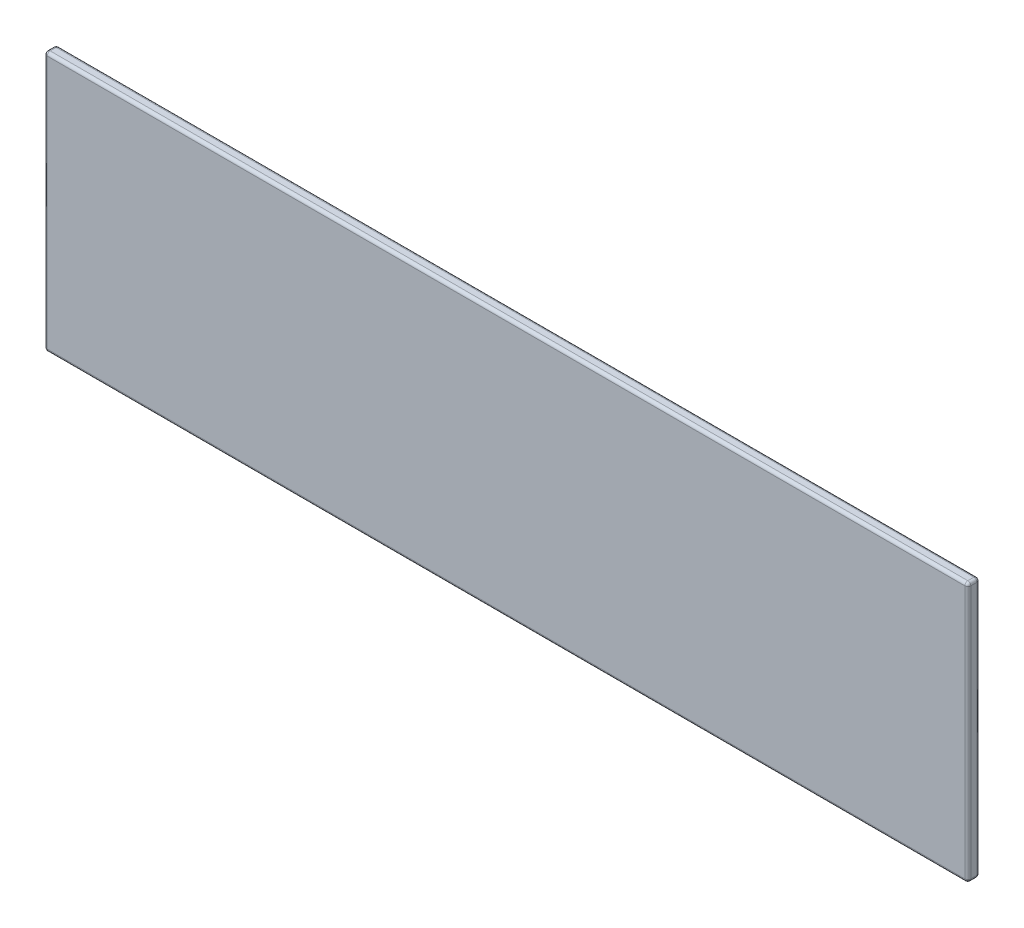
from build123d import *

# Parameters (mm, degrees)
SKETCH1_W           = 154.7
SKETCH1_H           = 43.5
BOSS_EXTRUDE1_DEPTH = 2
FILLET1_R           = 0.5


with BuildPart() as part:
    # Sketch1 → Boss-Extrude1 (new body)
    with BuildSketch(Plane.XY):
        Rectangle(SKETCH1_W, SKETCH1_H)
    extrude(amount=BOSS_EXTRUDE1_DEPTH)

    # Fillet1
    fillet1_edges = [part.edges().sort_by_distance(p)[0] for p in [
        (-77.35, 0, 2),
        (0, -21.75, 2),
        (77.35, 0, 2),
        (0, -21.75, 0),
        (-77.35, 0, 0),
        (0, 21.75, 0),
        (77.35, 0, 0),
        (77.35, -21.75, 1),
        (-77.35, -21.75, 1),
        (-77.35, 21.75, 1),
        (77.35, 21.75, 1),
        (0, 21.75, 2),
    ]]
    fillet(fillet1_edges, radius=FILLET1_R)


solid = part.part
